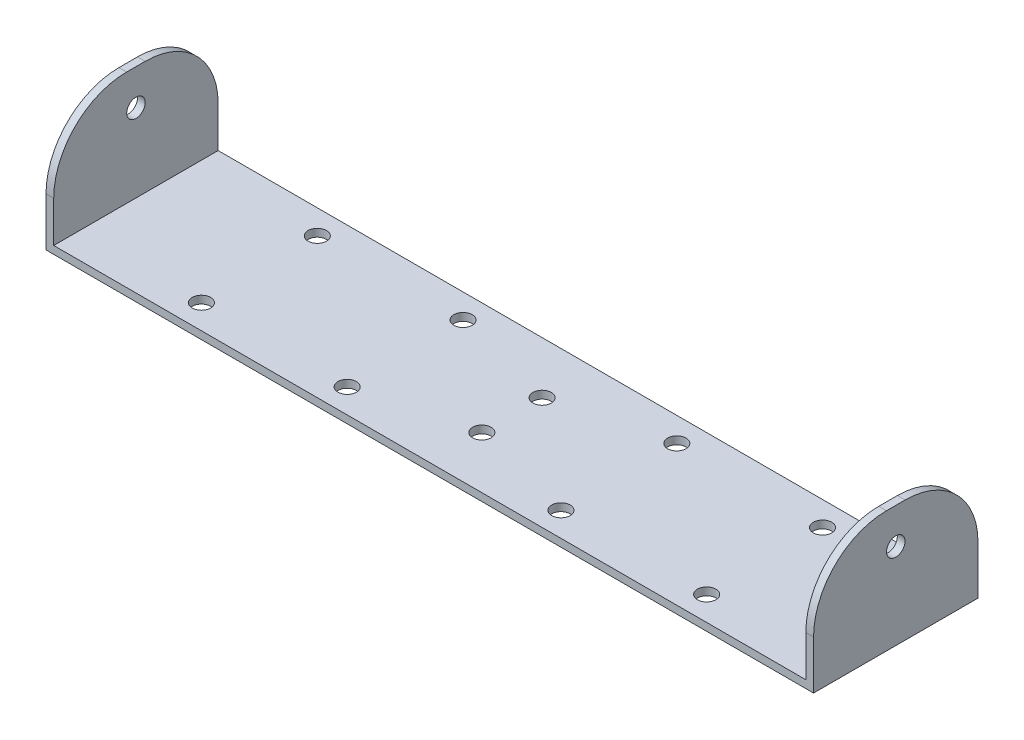
from build123d import *

# Parameters (mm, degrees)
BOSS_EXTRUDE1_DEPTH   = 33.85
F_6_CLEARANCE_HOLE1_D = 3.7973
F_6_CLEARANCE_HOLE2_D = 3.7973
FILLET1_R             = 15
FILLET1_OF_MIRROR1_R  = 15
F_6_CLEARANCE_HOLE3_D = 3.7973


with BuildPart() as part:
    # Sketch1 → Boss-Extrude1 (new body)
    with BuildSketch(Plane.XY):
        Polygon((0, 0), (-79, 0), (-79, 25), (-77.4125, 25), (-77.4125, 1.5875), (0, 1.5875), align=None)
    boss_extrude1 = extrude(amount=BOSS_EXTRUDE1_DEPTH)

    # #6 Clearance Hole1 (through all)
    with Locations(Plane.ZY.offset(79)):
        with Locations((16.925, 17.6675)):
            f_6_clearance_hole1 = Hole(F_6_CLEARANCE_HOLE1_D / 2)

    # #6 Clearance Hole2 (through all)
    with Locations(Plane(origin=(0, 0, 0), x_dir=(-1, 0, 0), z_dir=(0, -1, 0))):
        with Locations((22, -5), (52, -5), (52, -28.85), (22, -28.85)):
            f_6_clearance_hole2 = Hole(F_6_CLEARANCE_HOLE2_D / 2)

    # Fillet1
    fillet1_edges = [part.edges().sort_by_distance(p)[0] for p in [
        (-78.20625, 25, 33.85),
        (-78.20625, 25, 0),
    ]]
    fillet(fillet1_edges, radius=FILLET1_R)

    # Mirror1: Boss-Extrude1, #6 Clearance Hole1, #6 Clearance Hole2 across plane
    add(boss_extrude1.mirror(Plane(origin=(0, 0, 0), x_dir=(0, 0, 1), z_dir=(1, 0, 0))))
    add(f_6_clearance_hole1.mirror(Plane(origin=(0, 0, 0), x_dir=(0, 0, 1), z_dir=(1, 0, 0))), mode=Mode.SUBTRACT)
    add(f_6_clearance_hole2.mirror(Plane(origin=(0, 0, 0), x_dir=(0, 0, 1), z_dir=(1, 0, 0))), mode=Mode.SUBTRACT)

    # Fillet1 of Mirror1
    fillet1_of_mirror1_edges = [part.edges().sort_by_distance(p)[0] for p in [
        (78.20625, 25, 33.85),
        (78.20625, 25, 0),
    ]]
    fillet(fillet1_of_mirror1_edges, radius=FILLET1_OF_MIRROR1_R)

    # #6 Clearance Hole3 (through all)
    with Locations(Plane(origin=(0, 0, 0), x_dir=(-1, 0, 0), z_dir=(0, -1, 0))):
        with Locations((0, -23.125), (0, -10.725)):
            Hole(F_6_CLEARANCE_HOLE3_D / 2)


solid = part.part
